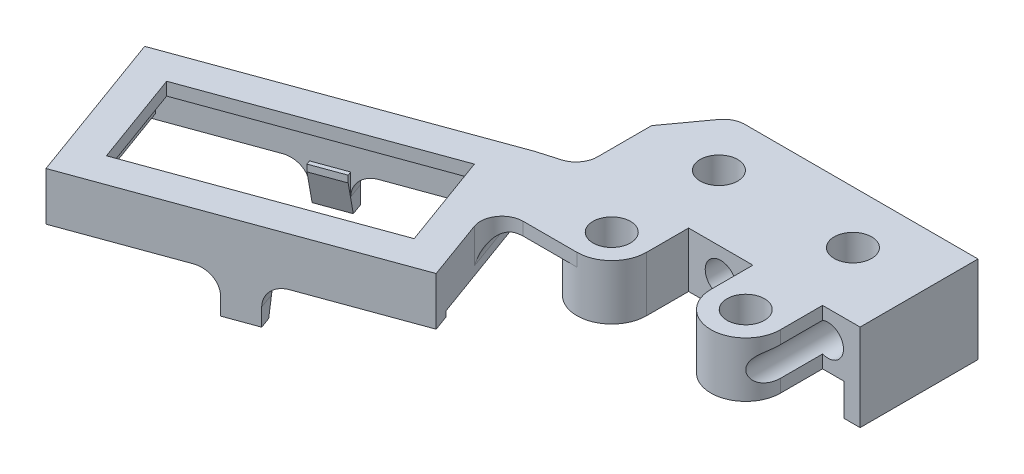
from build123d import *
from OCP.BRepFilletAPI import BRepFilletAPI_MakeChamfer

# Parameters (mm, degrees)
SKETCH1_W           = 26
SKETCH1_H           = 19.84
SKETCH1_R           = 1.7499999999999998
BOSS_EXTRUDE1_DEPTH = 5.13
CUT_EXTRUDE1_REACH  = 26.268
SKETCH2_R           = 1.45
BOSS_EXTRUDE2_DEPTH = 3
CUT_EXTRUDE2_REACH  = 20.262
CUT_EXTRUDE3_REACH  = 20.262
BOSS_EXTRUDE3_START = 1.2
BOSS_EXTRUDE3_DEPTH = 1.2
BOSS_EXTRUDE6_DEPTH = 3.3
BOSS_EXTRUDE7_DEPTH = 0.8
CUT_EXTRUDE4_DEPTH  = 0.5
CUT_EXTRUDE5_REACH  = 52.896
BOSS_EXTRUDE8_DEPTH = 2.83
FILLET1_R           = 2
CHAMFER1_SIZE       = 3
CHAMFER1_SIZE2      = 0.8038475772933701


with BuildPart() as part:
    # Sketch1 → Boss-Extrude1 (new body)
    with BuildSketch(Plane(origin=(0, 0, 0), x_dir=(1, 0, 0), z_dir=(0, 1, 0))):
        Rectangle(SKETCH1_W, SKETCH1_H)
        with Locations(Location((6.250000000000003, -4.999999999999995, 0), (0, 0, 270))):
            Circle(SKETCH1_R, mode=Mode.SUBTRACT)
        with Locations(Location((-6.250000000000001, -5, 0), (0, 0, 270))):
            Circle(SKETCH1_R, mode=Mode.SUBTRACT)
        with Locations(Location((-6.250000000000001, 5, 0), (0, 0, 270))):
            Circle(SKETCH1_R, mode=Mode.SUBTRACT)
        with Locations(Location((6.249999999999999, 4.999999999999998, 0), (0, 0, 270))):
            Circle(SKETCH1_R, mode=Mode.SUBTRACT)
    extrude(amount=BOSS_EXTRUDE1_DEPTH)

    # Sketch2 → Cut-Extrude1 (cut, up to next)
    with BuildSketch(Plane.XY.offset(9.92), mode=Mode.PRIVATE) as cut_extrude1_sk1:
        with Locations((0, 2.565)):
            Circle(SKETCH2_R)
    cut_extrude1_tool1 = extrude(cut_extrude1_sk1.sketch, amount=-CUT_EXTRUDE1_REACH, mode=Mode.PRIVATE) & part.part
    # Sketch2 → Cut-Extrude1 (cut, up to next)
    with BuildSketch(Plane.XY.offset(9.92), mode=Mode.PRIVATE) as cut_extrude1_sk2:
        with Locations((-10, 2.565)):
            Circle(SKETCH2_R)
    cut_extrude1_tool2 = extrude(cut_extrude1_sk2.sketch, amount=-CUT_EXTRUDE1_REACH, mode=Mode.PRIVATE) & part.part
    # Sketch2 → Cut-Extrude1 (cut, up to next)
    with BuildSketch(Plane.XY.offset(9.92), mode=Mode.PRIVATE) as cut_extrude1_sk3:
        with Locations(Location((10, 2.565, 0), (0, 0, 180))):
            Circle(SKETCH2_R)
    cut_extrude1_tool3 = extrude(cut_extrude1_sk3.sketch, amount=-CUT_EXTRUDE1_REACH, mode=Mode.PRIVATE) & part.part
    add(cut_extrude1_tool1.solids().sort_by_distance((0, 2.565, 9.92))[0], mode=Mode.SUBTRACT)
    add(cut_extrude1_tool2.solids().sort_by_distance((-10, 2.565, 9.92))[0], mode=Mode.SUBTRACT)
    add(cut_extrude1_tool3.solids().sort_by_distance((10, 2.565, 9.92))[0], mode=Mode.SUBTRACT)

    # Sketch3 → Boss-Extrude2 (add)
    with BuildSketch(Plane.XZ):
        with BuildLine():
            Line((-13, -9.919999999999998), (-11.034999999999997, -9.919999999999998))
            Line((-11.034999999999997, -9.92), (-11.63, 3.710000000000001))
            add(Edge.make_bspline(
                [(-11.63, 3.7100000000000013), (-10.51224572230246, 4.466321985960096), (-10.92, 6.040000000000002)],
                knots=[0, 0, 0, 1, 1, 1], degree=2))
            Line((-10.92, 6.040000000000002), (-9.0061377245509, 9.92))
            Line((-9.0061377245509, 9.92), (-13.000000000000002, 9.92))
            Line((-13.000000000000002, 9.92), (-13, -9.919999999999996))
        make_face()
        with BuildLine():
            Line((11.63, 3.7100000000000044), (11.035000000000004, -9.919999999999996))
            Line((11.035000000000004, -9.92), (13, -9.92))
            Line((12.999999999999998, -9.919999999999998), (12.999999999999995, 9.919999999999998))
            Line((12.999999999999995, 9.919999999999998), (9.006137724550902, 9.919999999999998))
            Line((9.0061377245509, 9.920000000000002), (10.92, 6.0400000000000045))
            add(Edge.make_bspline(
                [(11.63, 3.7100000000000044), (10.512245722302461, 4.466321985960101), (10.92, 6.0400000000000045)],
                knots=[0, 0, 0, 1, 1, 1], degree=2))
        make_face()
    extrude(amount=BOSS_EXTRUDE2_DEPTH)

    # Sketch4 → Cut-Extrude2 (cut, up to next)
    with BuildSketch(Plane.XZ.offset(3), mode=Mode.PRIVATE) as cut_extrude2_sk1:
        with BuildLine():
            Line((-13.000000000000002, 9.92), (-13.000000000000002, 1.0799999999999994))
            Line((-13.000000000000002, 1.0799999999999994), (-9.5, 1.0799999999999994))
            Line((-9.5, 1.0799999999999992), (-9.500000000000002, 5))
            ThreePointArc((-9.5, 4.999999999999999), (-6.250000000000002, 8.25), (-3.000000000000001, 5))
            Line((-3.000000000000001, 5), (-3.000000000000001, 1.0799999999999992))
            Line((-3.0000000000000018, 1.0799999999999994), (3.0000000000000018, 1.0799999999999994))
            Line((3.0000000000000027, 1.0799999999999992), (3.0000000000000036, 4.999999999999995))
            ThreePointArc((3.0000000000000027, 4.999999999999994), (6.250000000000002, 8.249999999999995), (9.500000000000004, 4.999999999999995))
            Line((9.500000000000002, 4.999999999999995), (9.500000000000002, 1.0799999999999992))
            Line((9.500000000000002, 1.0799999999999994), (11.515190755685987, 1.0799999999999994))
            Line((11.515190755685987, 1.0799999999999996), (11.63, 3.710000000000005))
            add(Edge.make_bspline(
                [(10.92, 6.0400000000000045), (10.512245722302461, 4.466321985960101), (11.63, 3.7100000000000044)],
                knots=[0, 0, 0, 1, 1, 1], degree=2))
            Line((10.92, 6.040000000000005), (9.006137724550895, 9.920000000000002))
            Line((9.006137724550895, 9.92), (-13.000000000000002, 9.92))
        make_face()
    cut_extrude2_tool1 = extrude(cut_extrude2_sk1.sketch, amount=-CUT_EXTRUDE2_REACH, mode=Mode.PRIVATE) & part.part
    # Sketch4 → Cut-Extrude2 (cut, up to next)
    with BuildSketch(Plane.XZ.offset(3), mode=Mode.PRIVATE) as cut_extrude2_sk2:
        with BuildLine():
            Line((12.999999999999998, 9.92), (9.006137724550895, 9.92))
            Line((9.006137724550895, 9.920000000000002), (10.92, 6.040000000000005))
            add(Edge.make_bspline(
                [(10.92, 6.0400000000000045), (10.512245722302461, 4.466321985960101), (11.63, 3.7100000000000044)],
                knots=[0, 0, 0, 1, 1, 1], degree=2))
            Line((11.63, 3.710000000000005), (11.515190755685987, 1.0799999999999996))
            Line((11.515190755685987, 1.0799999999999994), (12.999999999999998, 1.0799999999999994))
            Line((12.999999999999998, 1.08), (12.999999999999998, 9.92))
        make_face()
    cut_extrude2_tool2 = extrude(cut_extrude2_sk2.sketch, amount=-CUT_EXTRUDE2_REACH, mode=Mode.PRIVATE) & part.part
    add(cut_extrude2_tool1.solids().sort_by_distance((-1.890933, -3, 6.129401))[0], mode=Mode.SUBTRACT)
    add(cut_extrude2_tool2.solids().sort_by_distance((11.717022, -3, 6.350704))[0], mode=Mode.SUBTRACT)

    # Sketch5 → Cut-Extrude3 (cut, up to next)
    with BuildSketch(Plane(origin=(0, 5.13, 0), x_dir=(1, 0, 0), z_dir=(0, 1, 0)), mode=Mode.PRIVATE) as cut_extrude3_sk1:
        with BuildLine():
            Line((-13.000000000000002, 9.92), (-13.000000000000002, 5.470620579870581))
            Line((-13.000000000000004, 5.470620579870581), (-10.364706936690006, 9.097790307353499))
            ThreePointArc((-10.364706936690006, 9.097790307353499), (-9.696381549071102, 9.682348654000137), (-8.840876363748032, 9.919999999999996))
            Line((-8.840876363748032, 9.92), (-13.000000000000002, 9.92))
        make_face()
    cut_extrude3_tool1 = extrude(cut_extrude3_sk1.sketch, amount=-CUT_EXTRUDE3_REACH, mode=Mode.PRIVATE) & part.part
    add(cut_extrude3_tool1.solids().sort_by_distance((-11.876404, 5.13, -8.463849))[0], mode=Mode.SUBTRACT)

    # Sketch6 → Boss-Extrude3 (add)
    # profile 1 of 3: a face of its own
    with BuildSketch(Plane.XZ.offset(-5.13).offset(BOSS_EXTRUDE3_START)):
        Polygon((-11.098405421888891, 16.531452984385147), (-37.78567585220869, 26.24482505483415), (-43.05278605942399, 11.773558694731163), (-16.36551562910419, 2.060186624282162), (-14.112607804680097, 8.249999999999996), align=None)
        Polygon((-17.262024345294556, 3.9827557704495273), (-41.13021691325662, 12.67006741092152), (-36.88916713601833, 24.322255908666786), (-13.02097456805626, 15.63494426819479), align=None, mode=Mode.SUBTRACT)
    # profile 2 of 3: a face of its own
    with BuildSketch(Plane.XZ.offset(-5.13).offset(BOSS_EXTRUDE3_START)):
        Polygon((-41.13021691325662, 12.67006741092152), (-17.262024345294556, 3.982755770449528), (-13.020974568056259, 15.63494426819479), (-36.88916713601833, 24.322255908666786), align=None)
    # profile 3 of 3: a face of its own
    with BuildSketch(Plane.XZ.offset(-5.13).offset(BOSS_EXTRUDE3_START)):
        with BuildLine():
            Line((-6.250000000000001, 8.25), (-14.1126078046801, 8.249999999999998))
            Line((-14.112607804680097, 8.249999999999996), (-16.36551562910419, 2.060186624282161))
            Line((-16.36551562910419, 2.060186624282161), (-13.000000000000002, 1.0799999999999994))
            Line((-13.000000000000002, 1.0799999999999994), (-9.500000000000002, 1.0799999999999994))
            Line((-9.500000000000002, 1.0799999999999992), (-9.500000000000002, 5))
            ThreePointArc((-9.500000000000002, 5), (-8.54809703885628, 7.29809703885628), (-6.250000000000001, 8.25))
        make_face()
    extrude(amount=-BOSS_EXTRUDE3_DEPTH)

    # Sketch9 → Boss-Extrude6 (add)
    with BuildSketch(Plane.XZ.offset(-3.93)):
        Polygon((-43.052786059423994, 11.773558694731161), (-37.78567585220869, 26.244825054834152), (-11.098405421888893, 16.531452984385147), (-16.36551562910419, 2.060186624282161), align=None)
        Polygon((-41.13021691325663, 12.670067410921524), (-17.262024345294552, 3.982755770449528), (-13.020974568056255, 15.63494426819479), (-36.88916713601834, 24.32225590866679), align=None, mode=Mode.SUBTRACT)
    extrude(amount=BOSS_EXTRUDE6_DEPTH)

    # Sketch10 → Boss-Extrude7 (add)
    with BuildSketch(Plane.XZ.offset(-0.6300000000000003)):
        Polygon((-31.118689775442956, 7.429902874495164), (-28.299611913085236, 6.403842444518162), (-27.64977364076646, 8.189258424011385), (-30.46885150312418, 9.215318853988391), align=None)
        Polygon((-25.85157956822766, 21.901169234598154), (-23.032501705869944, 20.875108804621146), (-23.68233997818871, 19.089692825127923), (-26.50141784054643, 20.115753255104927), align=None)
    extrude(amount=BOSS_EXTRUDE7_DEPTH)

    # Sketch11 → Cut-Extrude4 (cut)
    with BuildSketch(Plane.XZ.offset(-0.6300000000000003)):
        Polygon((-17.262024345294552, 3.982755770449528), (-13.020974568056257, 15.634944268194793), (-11.611435636877394, 15.12191405320629), (-15.852485414115685, 3.469725555461025), align=None)
        Polygon((-36.889167136018344, 24.322255908666797), (-41.13021691325663, 12.670067410921524), (-42.53975584443549, 13.183097625910026), (-38.298706067197195, 24.835286123655298), align=None)
    extrude(amount=-CUT_EXTRUDE4_DEPTH, mode=Mode.SUBTRACT)

    # Sketch12 → Cut-Extrude5 (cut, up to next)
    with BuildSketch(Plane.XZ.offset(-3.93), mode=Mode.PRIVATE) as cut_extrude5_sk1:
        Polygon((-18.15853306148491, 5.9053249166168955), (-14.94354371422362, 14.738435552004432), (-35.99265841982798, 22.399686762499428), (-39.20764776708926, 13.566576127111883), align=None)
    cut_extrude5_tool1 = extrude(cut_extrude5_sk1.sketch, amount=-CUT_EXTRUDE5_REACH, mode=Mode.PRIVATE) & part.part
    add(cut_extrude5_tool1.solids().sort_by_distance((-27.075596, 3.93, 14.152506))[0], mode=Mode.SUBTRACT)

    # Sketch13 → Boss-Extrude8 (add)
    with BuildSketch(Plane.XZ.offset(0.16999999999999968)):
        Polygon((-30.46885150312418, 9.215318853988391), (-31.118689775442956, 7.429902874495164), (-28.299611913085236, 6.403842444518162), (-27.64977364076646, 8.189258424011385), align=None)
        Polygon((-25.85157956822766, 21.901169234598154), (-26.50141784054643, 20.115753255104927), (-23.68233997818871, 19.089692825127923), (-23.032501705869944, 20.875108804621146), align=None)
    extrude(amount=BOSS_EXTRUDE8_DEPTH)

    # Fillet1
    fillet1_edges = [part.edges().sort_by_distance(p)[0] for p in [
        (-30.862174667948704, 0.6300000000000003, 8.134672340084595),
        (-26.10809467572191, 0.6300000000000003, 21.196399769008725),
        (-23.289016813364192, 0.6300000000000003, 20.170339339031717),
        (-28.04309680559098, 0.6300000000000003, 7.108611910107593),
        (-13.000000000000002, 4.529999999999999, 1.0799999999999994),
        (-14.1126078046801, 4.529999999999999, 8.249999999999996),
        (-15.239061716892145, 3.93, 5.155093312141078),
    ]]
    fillet(fillet1_edges, radius=FILLET1_R)

    # Chamfer1: one chamfer whose edges measure the first distance from different faces: ONE call of the kernel's chamfer builder (chamfer() names one face for all edges)
    chamfer1_edges_1 = [part.edges().sort_by_distance(p)[0] for p in [
        (-29.05931257194532, -2.9999999999999996, 8.702288638999889),
    ]]
    chamfer1_side_1 = [part.faces().sort_by_distance(p)[0] for p in [
        (-29.059312571945316, -1.1849999999999996, 8.702288638999887),
    ]]
    chamfer1_edges_2 = [part.edges().sort_by_distance(p)[0] for p in [
        (-25.091878909367573, -2.9999999999999996, 19.602723040116423),
    ]]
    chamfer1_side_2 = [part.faces().sort_by_distance(p)[0] for p in [
        (-25.091878909367573, -1.1849999999999996, 19.602723040116427),
    ]]
    chamfer1 = BRepFilletAPI_MakeChamfer(part.part.solid().wrapped)
    for e in chamfer1_edges_1:
        chamfer1.Add(CHAMFER1_SIZE, CHAMFER1_SIZE2, e.wrapped, chamfer1_side_1[0].wrapped)  # the first distance lies on this face
    for e in chamfer1_edges_2:
        chamfer1.Add(CHAMFER1_SIZE, CHAMFER1_SIZE2, e.wrapped, chamfer1_side_2[0].wrapped)  # the first distance lies on this face
    add(Compound.cast(chamfer1.Shape()), mode=Mode.REPLACE)


solid = part.part
